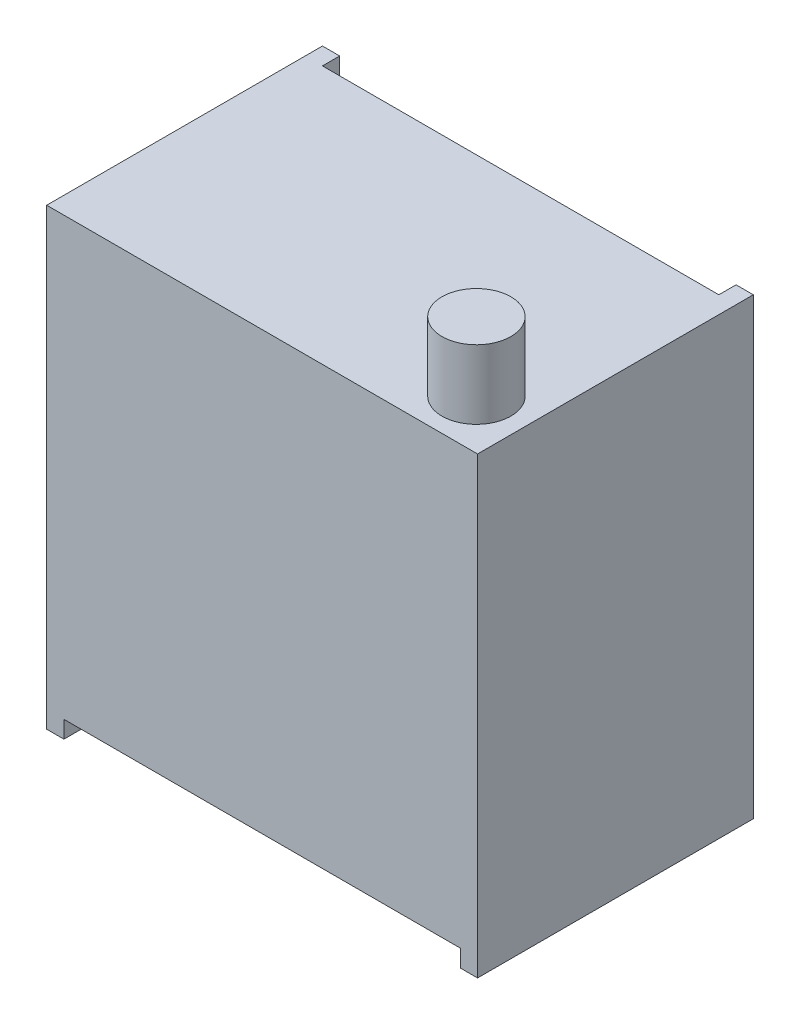
from build123d import *

# Parameters (mm, degrees)
BASE_EXTRUDE_DEPTH = 6.096
SKETCH2_W          = 8.763
SKETCH2_H          = 0.381
CUT_EXTRUDE1_DEPTH = 13.66900593
SKETCH3_R          = 0.762
SCREW_DEPTH        = 1.524
SKETCH4_R          = 0.254
PINS_DEPTH         = 1.524


with BuildPart() as part:
    # Sketch1 → Base-Extrude (new body)
    with BuildSketch(Plane.XY):
        Polygon((4.3815, 0), (4.7625, 0), (4.7625, 10.033), (-4.7625, 10.033), (-4.7625, 0), (-4.3815, 0), (-4.3815, 0.381), (4.3815, 0.381), align=None)
    extrude(amount=-BASE_EXTRUDE_DEPTH)

    # Sketch2 → Cut-Extrude1 (cut, through all)
    with BuildSketch(Plane(origin=(0, 10.033, 0), x_dir=(-1, 0, 0), z_dir=(0, 1, 0))):
        with Locations((0, -5.9055)):
            Rectangle(SKETCH2_W, SKETCH2_H)
    extrude(amount=-CUT_EXTRUDE1_DEPTH, mode=Mode.SUBTRACT)

    # Sketch3 → screw (add)
    with BuildSketch(Plane(origin=(0, 10.033, 0), x_dir=(-1, 0, 0), z_dir=(0, 1, 0))):
        with Locations(Location((-3.6449, -1.0922, 0), (0, 0, 270))):
            Circle(SKETCH3_R)
    extrude(amount=SCREW_DEPTH)

    # Sketch4 → Pins (add)
    with BuildSketch(Plane.XZ.offset(-0.381)):
        with Locations(Location((-2.54, -4.191, 0), (0, 0, 270))):
            Circle(SKETCH4_R)
        with Locations(Location((0, -4.191, 0), (0, 0, 270))):
            Circle(SKETCH4_R)
        with Locations(Location((2.54, -4.191, 0), (0, 0, 270))):
            Circle(SKETCH4_R)
    extrude(amount=PINS_DEPTH)


solid = part.part
